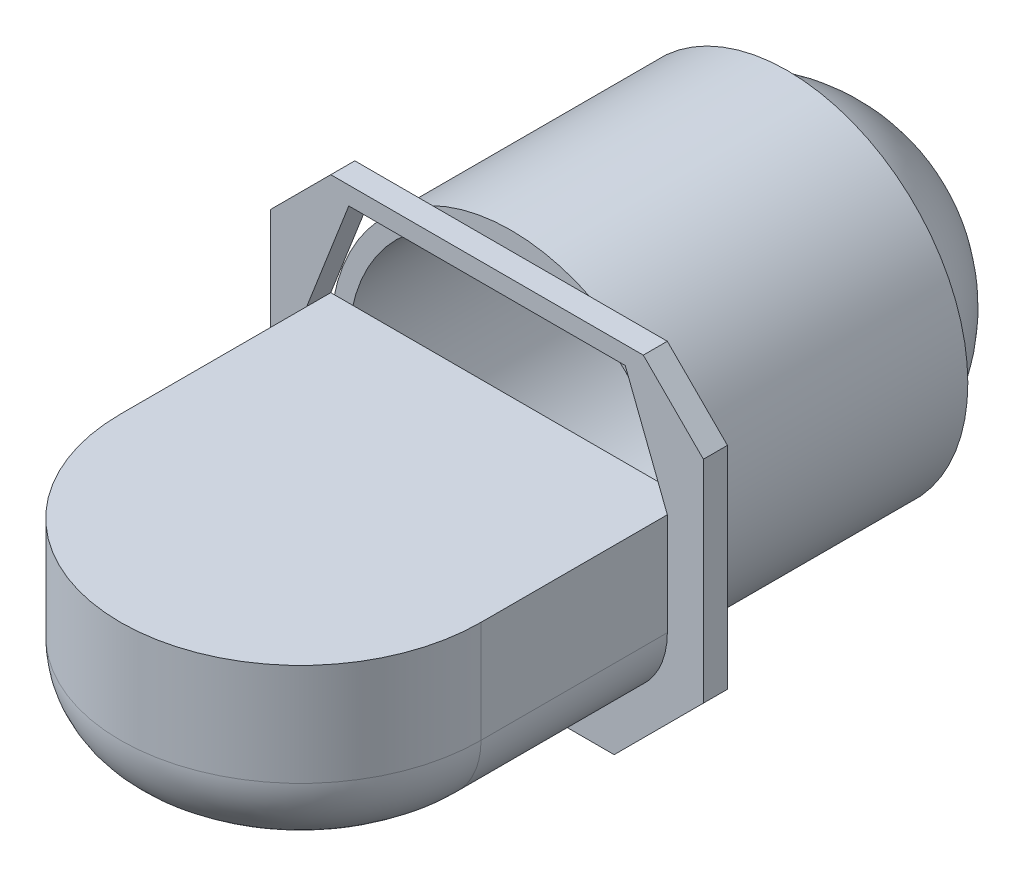
from build123d import *

# Parameters (mm, degrees)
SKETCH1_R                = 30
SKETCH1_R_2              = 27
BOSS_EXTRUDE1_DEPTH      = 46
BOSS_EXTRUDE2_DEPTH      = 6
BOSS_EXTRUDE2_DEPTH_BACK = 24
FILLET1_R                = 13
BOSS_EXTRUDE7_DEPTH      = 4


with BuildPart() as part:
    # Sketch1 → Boss-Extrude1 (new body)
    with BuildSketch(Plane.XY):
        Circle(SKETCH1_R)
        Circle(SKETCH1_R_2, mode=Mode.SUBTRACT)
    extrude(amount=BOSS_EXTRUDE1_DEPTH)


with BuildPart() as body_2:
    # Sketch3 → Revolve1 (revolve)
    with BuildSketch(Plane(origin=(0, 0, 0), x_dir=(1, 0, 0), z_dir=(0, 1, 0))):
        with BuildLine():
            Line((27, 0), (0, 0))
            Line((0, 0), (0, 20))
            ThreePointArc((0, 20), (16.800297616, 14.455401782), (27, 0))
        make_face()
    revolve(axis=Axis((0, 0, -24.323945347), (0, 0, 1)))


with BuildPart() as body_3:
    # Sketch5 → Boss-Extrude2 (new, two sides: drawn at the far end of the back side and taken through both)
    with BuildSketch(Plane(origin=(0, 0, 0), x_dir=(1, 0, 0), z_dir=(0, 1, 0)).offset(-BOSS_EXTRUDE2_DEPTH_BACK)):
        with BuildLine():
            Line((-30, -46), (-30, -81))
            ThreePointArc((-30, -81), (0, -111), (30, -81))
            Line((30, -81), (30, -46))
            Line((30, -46), (-30, -46))
        make_face()
    extrude(amount=BOSS_EXTRUDE2_DEPTH + BOSS_EXTRUDE2_DEPTH_BACK)

    # Fillet1
    fillet1_edges = [body_3.edges().sort_by_distance(p)[0] for p in [
        (0, -24, 111),
        (30, -24, 63.5),
        (-30, -24, 63.5),
    ]]
    fillet(fillet1_edges, radius=FILLET1_R)

    # Sketch7 → Boss-Extrude7 (add)
    with BuildSketch(Plane.XY.offset(46)):
        Polygon((-36, 17), (-36, -18.150757595), (-21.150757595, -33), (21.150757595, -33), (36, -18.150757595), (36, 17), (26, 27), (-26, 27), align=None)
        Polygon((-30, 6), (30, 6), (23, 24), (-23, 24), align=None, mode=Mode.SUBTRACT)
    extrude(amount=BOSS_EXTRUDE7_DEPTH)


solid = Compound([part.part, body_2.part, body_3.part])
